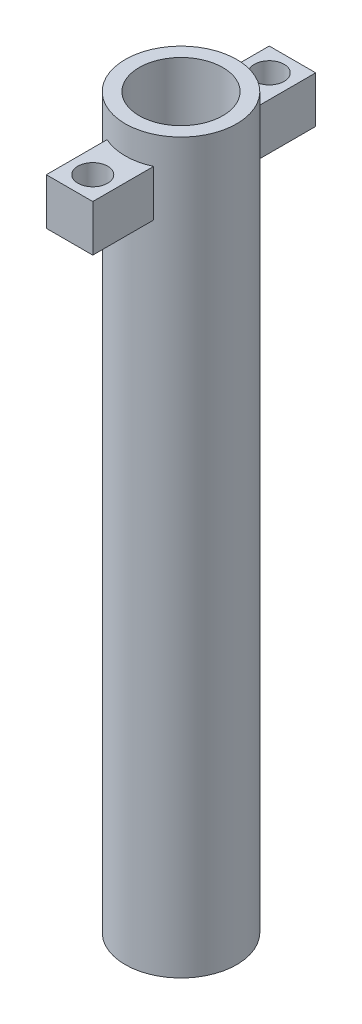
from build123d import *
from build123d.topology import SkipClean

# Parameters (mm, degrees)
SKETCH1_R           = 6
SKETCH1_R_2         = 4.5
BOSS_EXTRUDE1_DEPTH = 78.4
BOSS_EXTRUDE2_START = -8
SKETCH2_R           = 1.6
SKETCH2_R_2         = 4.5
BOSS_EXTRUDE2_DEPTH = 8
SKETCH3_OUTSIDE_W   = 30.572
SKETCH3_OUTSIDE_H   = 42.572
SKETCH3_OUTSIDE_R   = 6
CUT_EXTRUDE1_DEPTH  = 3


with BuildPart() as part:
    # Sketch1 → Boss-Extrude1 (new body)
    with BuildSketch(Plane(origin=(0, 0, 0), x_dir=(1, 0, 0), z_dir=(0, 1, 0))):
        with Locations(Location((0, 0, 0), (0, 0, 270))):
            Circle(SKETCH1_R)
        with Locations(Location((0, 0, 0), (0, 0, 270))):
            Circle(SKETCH1_R_2, mode=Mode.SUBTRACT)
    extrude(amount=BOSS_EXTRUDE1_DEPTH)

    # Sketch2 → Boss-Extrude2 (add)
    with SkipClean():  # the faces are left unmerged after this step: merging them gives an invalid solid
        with BuildSketch(Plane(origin=(0, 78.4, 0), x_dir=(1, 0, 0), z_dir=(0, 1, 0)).offset(BOSS_EXTRUDE2_START)):
            with BuildLine():
                Line((-2.5, 12), (2.5, 12))
                Line((2.5, 12), (2.5, 5.454356057))
                ThreePointArc((2.5, 5.454356057), (6, 0), (2.5, -5.454356057))
                Line((2.5, -5.454356057), (2.5, -12))
                Line((2.5, -12), (-2.5, -12))
                Line((-2.5, -12), (-2.5, -5.454356057))
                ThreePointArc((-2.5, -5.454356057), (-6, 0), (-2.5, 5.454356057))
                Line((-2.5, 5.454356057), (-2.5, 12))
            make_face()
            with Locations(Location((0, 9.5, 0), (0, 0, 270))):
                Circle(SKETCH2_R, mode=Mode.SUBTRACT)
            with Locations(Location((0, -9.5, 0), (0, 0, 270))):
                Circle(SKETCH2_R, mode=Mode.SUBTRACT)
            with Locations(Location((0, 0, 0), (0, 0, 270))):
                Circle(SKETCH2_R_2, mode=Mode.SUBTRACT)
        extrude(amount=BOSS_EXTRUDE2_DEPTH)

    # Sketch3 outside → Cut-Extrude1 (cut)
    with SkipClean():  # the faces are left unmerged after this step: merging them gives an invalid solid
        with BuildSketch(Plane(origin=(0, 78.4, 0), x_dir=(1, 0, 0), z_dir=(0, 1, 0))):
            Rectangle(SKETCH3_OUTSIDE_W, SKETCH3_OUTSIDE_H)
            with Locations(Location((0, 0, 0), (0, 0, 270))):
                Circle(SKETCH3_OUTSIDE_R, mode=Mode.SUBTRACT)
        extrude(amount=-CUT_EXTRUDE1_DEPTH, mode=Mode.SUBTRACT)


solid = part.part
